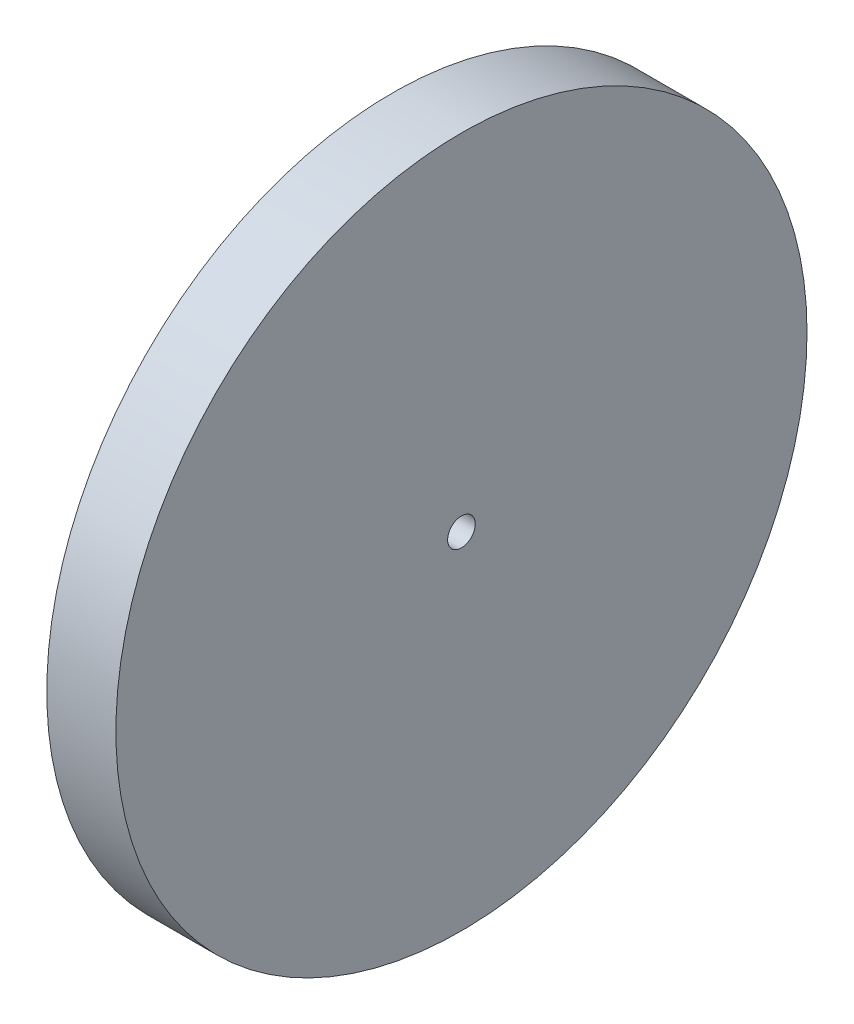
from build123d import *

# Parameters (mm, degrees)
SKETCH1_R           = 100
BOSS_EXTRUDE1_DEPTH = 20
SKETCH2_R           = 70
BOSS_EXTRUDE2_DEPTH = 20
CUT_EXTRUDE1_REACH  = 148.969
SKETCH3_R           = 4


with BuildPart() as part:
    # Sketch1 → Boss-Extrude1 (new body)
    with BuildSketch(Plane(origin=(0, 0, 0), x_dir=(0, 0, -1), z_dir=(1, 0, 0))):
        Circle(SKETCH1_R)
    extrude(amount=BOSS_EXTRUDE1_DEPTH)

    # Sketch2 → Boss-Extrude2 (add)
    with BuildSketch(Plane.ZY):
        Circle(SKETCH2_R)
    extrude(amount=BOSS_EXTRUDE2_DEPTH)

    # Sketch3 → Cut-Extrude1 (cut, up to next)
    with BuildSketch(Plane.ZY.offset(20), mode=Mode.PRIVATE) as cut_extrude1_sk1:
        Circle(SKETCH3_R)
    cut_extrude1_tool1 = extrude(cut_extrude1_sk1.sketch, amount=-CUT_EXTRUDE1_REACH, mode=Mode.PRIVATE) & part.part
    add(cut_extrude1_tool1.solids().sort_by_distance((-20, 0, 0))[0], mode=Mode.SUBTRACT)


solid = part.part
